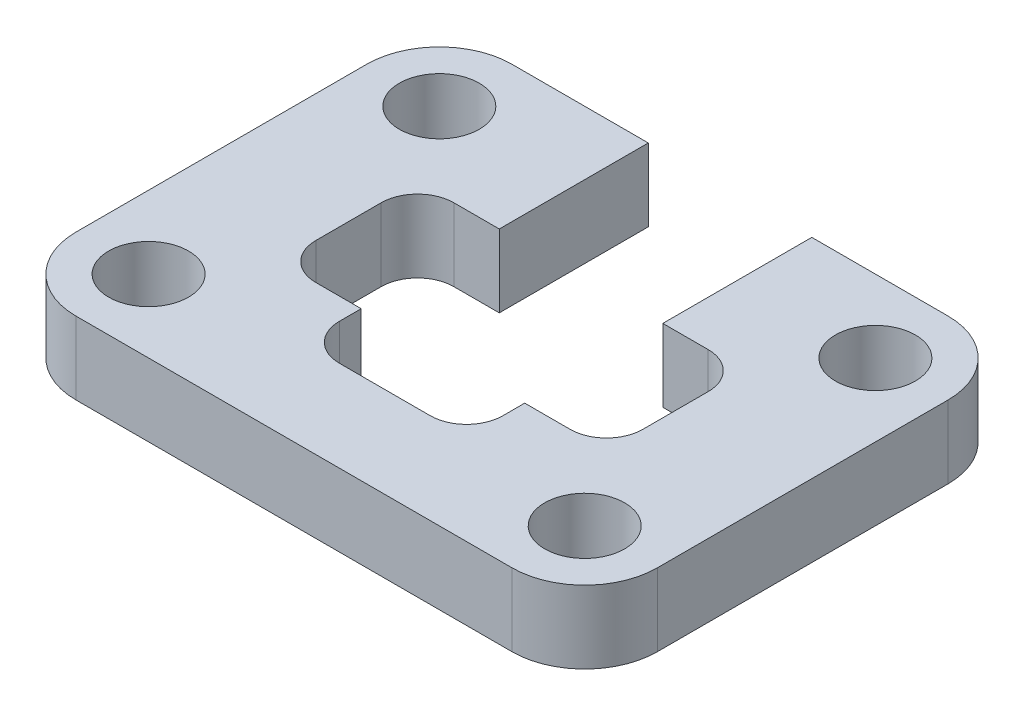
from build123d import *

# Parameters (mm, degrees)
SKETCH_1_R          = 1.1
EXTRUDE_1_DEPTH     = 2
SKETCH_2_W          = 9
SKETCH_2_H          = 3.8
CUT_EXTRUDE_1_DEPTH = 11.198039027
FILLET_1_R          = 2
FILLET_2_R          = 1


with BuildPart() as part:
    # 草图1 → 凸台-拉伸1 (new body)
    with BuildSketch(Plane(origin=(0, 0, 0), x_dir=(1, 0, 0), z_dir=(0, 1, 0))):
        Polygon((-8, 6), (-8, -6), (8, -6), (8, 6), (2.25, 6), (2.25, -3.5), (-2.25, -3.5), (-2.25, 6), align=None)
        with Locations(Location((-6, -4, 0), (0, 0, 270))):
            Circle(SKETCH_1_R, mode=Mode.SUBTRACT)
        with Locations(Location((6, -4, 0), (0, 0, 270))):
            Circle(SKETCH_1_R, mode=Mode.SUBTRACT)
        with Locations(Location((-6, 4, 0), (0, 0, 270))):
            Circle(SKETCH_1_R, mode=Mode.SUBTRACT)
        with Locations(Location((6, 4, 0), (0, 0, 270))):
            Circle(SKETCH_1_R, mode=Mode.SUBTRACT)
    extrude(amount=EXTRUDE_1_DEPTH)

    # 草图2 → 切除-拉伸1 (cut, through all)
    with BuildSketch(Plane(origin=(0, 2, 0), x_dir=(1, 0, 0), z_dir=(0, 1, 0))):
        Rectangle(SKETCH_2_W, SKETCH_2_H)
    extrude(amount=-CUT_EXTRUDE_1_DEPTH, mode=Mode.SUBTRACT)

    # 圆角1
    fillet_1_edges = [part.edges().sort_by_distance(p)[0] for p in [
        (8, 1, -6),
        (8, 1, 6),
        (-8, 1, 6),
        (-8, 1, -6),
    ]]
    fillet(fillet_1_edges, radius=FILLET_1_R)

    # 圆角2
    fillet_2_edges = [part.edges().sort_by_distance(p)[0] for p in [
        (-2.25, 1, 3.5),
        (2.25, 1, 3.5),
        (-4.5, 1, -1.9),
        (4.5, 1, -1.9),
        (4.5, 1, 1.9),
        (-4.5, 1, 1.9),
    ]]
    fillet(fillet_2_edges, radius=FILLET_2_R)


solid = part.part
